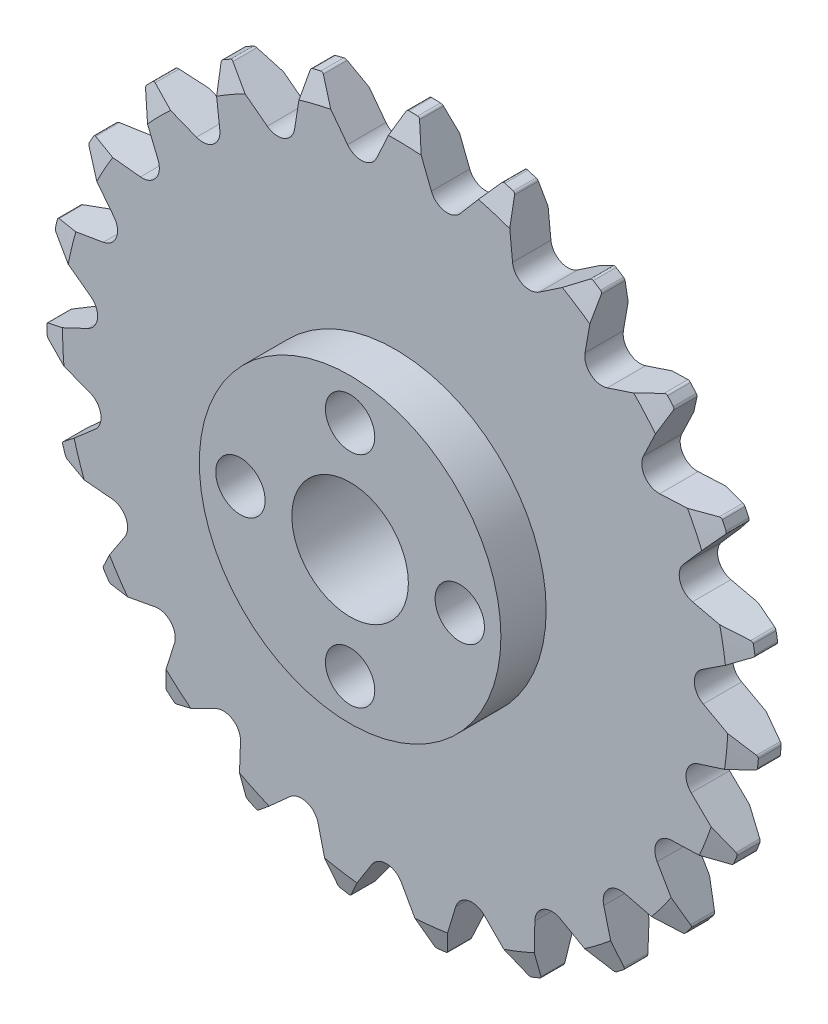
from build123d import *

# Parameters (mm, degrees)
SKETCH1_W                  = 26
SKETCH1_H                  = 2.7999944
CUT_EXTRUDE1_DEPTH         = 37.876008036
CUT_EXTRUDE2_DEPTH         = 37.876008036
CUT_EXTRUDE3_DEPTH         = 37.876008036
CUT_EXTRUDE4_DEPTH         = 37.876008036
CUT_EXTRUDE5_DEPTH         = 37.876008036
CUT_EXTRUDE6_DEPTH         = 37.876008036
CUT_EXTRUDE7_DEPTH         = 37.876008036
CUT_EXTRUDE8_DEPTH         = 37.876008036
CUT_EXTRUDE9_DEPTH         = 37.876008036
CUT_EXTRUDE10_DEPTH        = 37.876008036
CUT_EXTRUDE11_DEPTH        = 37.876008036
CUT_EXTRUDE12_DEPTH        = 37.876008036
CUT_EXTRUDE13_DEPTH        = 37.876008036
CUT_EXTRUDE14_DEPTH        = 37.876008036
CUT_EXTRUDE15_DEPTH        = 37.876008036
CUT_EXTRUDE16_DEPTH        = 37.871323245
CUT_EXTRUDE17_DEPTH        = 37.871323245
CUT_EXTRUDE18_DEPTH        = 37.871323245
CUT_EXTRUDE19_DEPTH        = 37.871323245
CUT_EXTRUDE20_DEPTH        = 37.871323245
CUT_EXTRUDE21_DEPTH        = 37.871323245
CUT_EXTRUDE22_DEPTH        = 37.870167928
CUT_EXTRUDE23_DEPTH        = 37.870167928
SKETCH25_W                 = 11
SKETCH25_H                 = 3.302
F_8_0_8_DIAMETER_HOLE1_D   = 8.5
F_3_6_3_6_DIAMETER_HOLE1_D = 3.6
F_3_6_3_6_DIAMETER_HOLE2_D = 3.6
FILLET1_R                  = 0.2


with BuildPart() as part:
    # Sketch1 → Revolve1 (revolve)
    with BuildSketch(Plane(origin=(0, 0, 0), x_dir=(1, 0, 0), z_dir=(0, 1, 0))):
        with Locations((13, 1.3999972)):
            Rectangle(SKETCH1_W, SKETCH1_H)
    revolve(axis=Axis((0, 0, -2.7999944), (0, 0, 1)))

    # Sketch2 → Cut-Extrude1 (cut, through all)
    with BuildSketch(Plane(origin=(0, 0, -2.7999944), x_dir=(-1, 0, 0), z_dir=(0, 0, -1))):
        with BuildLine():
            Line((18.801313039, 17.958580902), (17.308486788, 14.31139503))
            ThreePointArc((17.308486788, 14.31139503), (17.465043178, 13.088273063), (18.595024492, 12.594634046))
            Line((18.595024492, 12.594634046), (22.514630462, 13.003515492))
            ThreePointArc((22.514630462, 13.003515492), (20.80600791, 15.591986238), (18.801313039, 17.958580902))
        make_face()
    extrude(amount=-CUT_EXTRUDE1_DEPTH, mode=Mode.SUBTRACT)

    # Sketch3 → Cut-Extrude2 (cut, through all)
    with BuildSketch(Plane(origin=(0, 0, -2.7999944), x_dir=(-1, 0, 0), z_dir=(0, 0, -1))):
        with BuildLine():
            Line((22.949276492, 12.220094456), (20.527809316, 9.110915831))
            ThreePointArc((20.527809316, 9.110915831), (20.348565813, 7.890912137), (21.303462141, 7.110713283))
            Line((21.303462141, 7.110713283), (25.188033384, 6.446935261))
            ThreePointArc((25.188033384, 6.446935261), (24.24113224, 9.400399338), (22.949276492, 12.220094456))
        make_face()
    extrude(amount=-CUT_EXTRUDE2_DEPTH, mode=Mode.SUBTRACT)

    # Sketch4 → Cut-Extrude3 (cut, through all)
    with BuildSketch(Plane(origin=(0, 0, -2.7999944), x_dir=(-1, 0, 0), z_dir=(0, 0, -1))):
        with BuildLine():
            Line((25.395197093, 5.575299507), (22.224678136, 3.234721685))
            ThreePointArc((22.224678136, 3.234721685), (21.72292841, 2.108318355), (22.431919461, 1.099423446))
            Line((22.431919461, 1.099423446), (25.993355097, -0.587784666))
            ThreePointArc((25.993355097, -0.587784666), (25.878402688, 2.511627823), (25.395197093, 5.575299507))
        make_face()
    extrude(amount=-CUT_EXTRUDE3_DEPTH, mode=Mode.SUBTRACT)

    # Sketch5 → Cut-Extrude4 (cut, through all)
    with BuildSketch(Plane(origin=(0, 0, -2.7999944), x_dir=(-1, 0, 0), z_dir=(0, 0, -1))):
        with BuildLine():
            Line((25.957672102, -1.482989902), (22.273244249, -2.881376971))
            ThreePointArc((22.273244249, -2.881376971), (21.486200783, -3.830639754), (21.896703933, -4.993405599))
            Line((21.896703933, -4.993405599), (24.870868574, -7.578911293))
            ThreePointArc((24.870868574, -7.578911293), (25.596390394, -4.563419638), (25.957672102, -1.482989902))
        make_face()
    extrude(amount=-CUT_EXTRUDE4_DEPTH, mode=Mode.SUBTRACT)

    # Sketch6 → Cut-Extrude5 (cut, through all)
    with BuildSketch(Plane(origin=(0, 0, -2.7999944), x_dir=(-1, 0, 0), z_dir=(0, 0, -1))):
        with BuildLine():
            Line((24.594985319, -8.431292733), (20.669905729, -8.783777078))
            ThreePointArc((20.669905729, -8.783777078), (19.655939936, -9.485496836), (19.737510045, -10.715896595))
            Line((19.737510045, -10.715896595), (21.903823506, -14.00794474))
            ThreePointArc((21.903823506, -14.00794474), (23.416010921, -11.30001914), (24.594985319, -8.431292733))
        make_face()
    extrude(amount=-CUT_EXTRUDE5_DEPTH, mode=Mode.SUBTRACT)

    # Sketch7 → Cut-Extrude6 (cut, through all)
    with BuildSketch(Plane(origin=(0, 0, -2.7999944), x_dir=(-1, 0, 0), z_dir=(0, 0, -1))):
        with BuildLine():
            Line((21.40820099, -14.754285153), (17.53357486, -14.034724622))
            ThreePointArc((17.53357486, -14.034724622), (16.367887944, -14.436858011), (16.11447533, -15.643638561))
            Line((16.11447533, -15.643638561), (17.312272051, -19.398073008))
            ThreePointArc((17.312272051, -19.398073008), (19.498973038, -17.198547917), (21.40820099, -14.754285153))
        make_face()
    extrude(amount=-CUT_EXTRUDE6_DEPTH, mode=Mode.SUBTRACT)

    # Sketch8 → Cut-Extrude7 (cut, through all)
    with BuildSketch(Plane(origin=(0, 0, -2.7999944), x_dir=(-1, 0, 0), z_dir=(0, 0, -1))):
        with BuildLine():
            Line((16.633668329, -19.98301974), (13.096858955, -18.244780846))
            ThreePointArc((13.096858955, -18.244780846), (11.865904582, -18.317503472), (11.296303699, -19.411163421))
            Line((11.296303699, -19.411163421), (11.436748577, -23.349534942))
            ThreePointArc((11.436748577, -23.349534942), (14.135785527, -21.821539073), (16.633668329, -19.98301974))
        make_face()
    extrude(amount=-CUT_EXTRUDE7_DEPTH, mode=Mode.SUBTRACT)

    # Sketch9 → Cut-Extrude8 (cut, through all)
    with BuildSketch(Plane(origin=(0, 0, -2.7999944), x_dir=(-1, 0, 0), z_dir=(0, 0, -1))):
        with BuildLine():
            Line((10.625492582, -23.729705169), (7.688808935, -21.101705139))
            ThreePointArc((7.688808935, -21.101705139), (6.48388136, -20.839623497), (5.6403369, -21.739051089))
            Line((5.6403369, -21.739051089), (4.713013781, -25.569268685))
            ThreePointArc((4.713013781, -25.569268685), (7.724211471, -24.826126503), (10.625492582, -23.729705169))
        make_face()
    extrude(amount=-CUT_EXTRUDE8_DEPTH, mode=Mode.SUBTRACT)

    # Sketch10 → Cut-Extrude9 (cut, through all)
    with BuildSketch(Plane(origin=(0, 0, -2.7999944), x_dir=(-1, 0, 0), z_dir=(0, 0, -1))):
        with BuildLine():
            Line((3.829272659, -25.716466921), (1.71051513, -22.393612495))
            ThreePointArc((1.71051513, -22.393612495), (0.620978318, -21.816163983), (-0.433947885, -22.454652788))
            Line((-0.433947885, -22.454652788), (-2.360263687, -25.892646742))
            ThreePointArc((-2.360263687, -25.892646742), (0.739767985, -25.989473702), (3.829272659, -25.716466921))
        make_face()
    extrude(amount=-CUT_EXTRUDE9_DEPTH, mode=Mode.SUBTRACT)

    # Sketch11 → Cut-Extrude10 (cut, through all)
    with BuildSketch(Plane(origin=(0, 0, -2.7999944), x_dir=(-1, 0, 0), z_dir=(0, 0, -1))):
        with BuildLine():
            Line((-3.250946899, -25.795955967), (-4.394639757, -22.024688057))
            ThreePointArc((-4.394639757, -22.024688057), (-5.287979844, -21.174699388), (-6.47604874, -21.504895613))
            Line((-6.47604874, -21.504895613), (-9.258491195, -24.295685642))
            ThreePointArc((-9.258491195, -24.295685642), (-6.299540707, -25.225300531), (-3.250946899, -25.795955967))
        make_face()
    extrude(amount=-CUT_EXTRUDE10_DEPTH, mode=Mode.SUBTRACT)

    # Sketch12 → Cut-Extrude11 (cut, through all)
    with BuildSketch(Plane(origin=(0, 0, -2.7999944), x_dir=(-1, 0, 0), z_dir=(0, 0, -1))):
        with BuildLine():
            Line((-10.090058599, -23.962276968), (-10.173864317, -20.022293262))
            ThreePointArc((-10.173864317, -20.022293262), (-10.804752732, -18.962804207), (-12.037850686, -18.960218709))
            Line((-12.037850686, -18.960218709), (-15.470058766, -20.896824682))
            ThreePointArc((-15.470058766, -20.896824682), (-12.871641284, -22.590282217), (-10.090058599, -23.962276968))
        make_face()
    extrude(amount=-CUT_EXTRUDE11_DEPTH, mode=Mode.SUBTRACT)

    # Sketch13 → Cut-Extrude12 (cut, through all)
    with BuildSketch(Plane(origin=(0, 0, -2.7999944), x_dir=(-1, 0, 0), z_dir=(0, 0, -1))):
        with BuildLine():
            Line((-16.18083681, -20.351425506), (-15.198539903, -16.534936571))
            ThreePointArc((-15.198539903, -16.534936571), (-15.520186538, -15.344524588), (-16.706860316, -15.00934912))
            Line((-16.706860316, -15.00934912), (-20.534282848, -15.948141832))
            ThreePointArc((-20.534282848, -15.948141832), (-18.489111111, -18.279846015), (-16.18083681, -20.351425506))
        make_face()
    extrude(amount=-CUT_EXTRUDE12_DEPTH, mode=Mode.SUBTRACT)

    # Sketch14 → Cut-Extrude13 (cut, through all)
    with BuildSketch(Plane(origin=(0, 0, -2.7999944), x_dir=(-1, 0, 0), z_dir=(0, 0, -1))):
        with BuildLine():
            Line((-21.071556378, -15.231201916), (-19.096009313, -11.821259277))
            ThreePointArc((-19.096009313, -11.821259277), (-19.084559109, -10.588211776), (-20.136798545, -9.94530477))
            Line((-20.136798545, -9.94530477), (-24.07557311, -9.816658261))
            ThreePointArc((-24.07557311, -9.816658261), (-22.735328148, -12.613677259), (-21.071556378, -15.231201916))
        make_face()
    extrude(amount=-CUT_EXTRUDE13_DEPTH, mode=Mode.SUBTRACT)

    # Sketch15 → Cut-Extrude14 (cut, through all)
    with BuildSketch(Plane(origin=(0, 0, -2.7999944), x_dir=(-1, 0, 0), z_dir=(0, 0, -1))):
        with BuildLine():
            Line((-24.399495006, -8.981349757), (-21.577215071, -6.230853262))
            ThreePointArc((-21.577215071, -6.230853262), (-21.233517237, -5.046619734), (-22.073282546, -4.143662662))
            Line((-22.073282546, -4.143662662), (-25.831288253, -2.957118055))
            ThreePointArc((-25.831288253, -2.957118055), (-25.295369904, -6.012009764), (-24.399495006, -8.981349757))
        make_face()
    extrude(amount=-CUT_EXTRUDE14_DEPTH, mode=Mode.SUBTRACT)

    # Sketch16 → Cut-Extrude15 (cut, through all)
    with BuildSketch(Plane(origin=(0, 0, -2.7999944), x_dir=(-1, 0, 0), z_dir=(0, 0, -1))):
        with BuildLine():
            Line((-25.917834709, -2.065391975), (-22.458137497, -0.178333364))
            ThreePointArc((-22.458137497, -0.178333364), (-21.807682528, 0.869257006), (-22.372692159, 1.965295949))
            Line((-22.372692159, 1.965295949), (-25.671214916, 4.12173807))
            ThreePointArc((-25.671214916, 4.12173807), (-25.979369793, 1.035540992), (-25.917834709, -2.065391975))
        make_face()
    extrude(amount=-CUT_EXTRUDE15_DEPTH, mode=Mode.SUBTRACT)

    # Sketch17 → Cut-Extrude16 (cut, through all)
    with BuildSketch(Plane(origin=(0, 0, -2.7999944), x_dir=(-1, 0, 0), z_dir=(0, 0, -1))):
        with BuildLine():
            Line((-25.513967178, 5.003746482), (-21.673442603, 5.887412704))
            ThreePointArc((-21.673442603, 5.887412704), (-20.76447177, 6.720664931), (-21.012821543, 7.928497551))
            Line((-21.012821543, 7.928497551), (-23.607225007, 10.894903738))
            ThreePointArc((-23.607225007, 10.894903738), (-24.736598672, 8.00629041), (-25.513967178, 5.003746482))
        make_face()
    extrude(amount=-CUT_EXTRUDE16_DEPTH, mode=Mode.SUBTRACT)

    # Sketch18 → Cut-Extrude17 (cut, through all)
    with BuildSketch(Plane(origin=(0, 0, -2.7999944), x_dir=(-1, 0, 0), z_dir=(0, 0, -1))):
        with BuildLine():
            Line((-23.21784542, 11.701779953), (-19.281327621, 11.516516304))
            ThreePointArc((-19.281327621, 11.516516304), (-18.181255132, 12.073631883), (-18.09452608, 13.30367876))
            Line((-18.09452608, 13.30367876), (-19.792395215, 16.860044236))
            ThreePointArc((-19.792395215, 16.860044236), (-21.65922719, 14.383249894), (-23.21784542, 11.701779953))
        make_face()
    extrude(amount=-CUT_EXTRUDE17_DEPTH, mode=Mode.SUBTRACT)

    # Sketch19 → Cut-Extrude18 (cut, through all)
    with BuildSketch(Plane(origin=(0, 0, -2.7999944), x_dir=(-1, 0, 0), z_dir=(0, 0, -1))):
        with BuildLine():
            Line((-19.199762281, 17.531945937), (-15.459204775, 16.291492575))
            ThreePointArc((-15.459204775, 16.291492575), (-14.249617974, 16.531152791), (-13.834242395, 17.692186975))
            Line((-13.834242395, 17.692186975), (-14.509654015, 21.574752383))
            ThreePointArc((-14.509654015, 21.574752383), (-16.975489912, 19.693469533), (-19.199762281, 17.531945937))
        make_face()
    extrude(amount=-CUT_EXTRUDE18_DEPTH, mode=Mode.SUBTRACT)

    # Sketch20 → Cut-Extrude19 (cut, through all)
    with BuildSketch(Plane(origin=(0, 0, -2.7999944), x_dir=(-1, 0, 0), z_dir=(0, 0, -1))):
        with BuildLine():
            Line((-13.757720608, 22.061847694), (-10.490543432, 19.85820337))
            ThreePointArc((-10.490543432, 19.85820337), (-9.261151839, 19.762633722), (-8.547936239, 20.768546619))
            Line((-8.547936239, 20.768546619), (-8.150798153, 24.689359843))
            ThreePointArc((-8.150798153, 24.689359843), (-11.032758204, 23.543114628), (-13.757720608, 22.061847694))
        make_face()
    extrude(amount=-CUT_EXTRUDE19_DEPTH, mode=Mode.SUBTRACT)

    # Sketch21 → Cut-Extrude20 (cut, through all)
    with BuildSketch(Plane(origin=(0, 0, -2.7999944), x_dir=(-1, 0, 0), z_dir=(0, 0, -1))):
        with BuildLine():
            Line((-7.295331734, 24.955523134), (-4.743846474, 21.952122067))
            ThreePointArc((-4.743846474, 21.952122067), (-3.585828439, 21.528410517), (-2.627668756, 22.30459817))
            Line((-2.627668756, 22.30459817), (-1.187434879, 25.972870431))
            ThreePointArc((-1.187434879, 25.972870431), (-4.271777292, 25.646674614), (-7.295331734, 24.955523134))
        make_face()
    extrude(amount=-CUT_EXTRUDE20_DEPTH, mode=Mode.SUBTRACT)

    # Sketch22 → Cut-Extrude21 (cut, through all)
    with BuildSketch(Plane(origin=(0, 0, -2.7999944), x_dir=(-1, 0, 0), z_dir=(0, 0, -1))):
        with BuildLine():
            Line((-0.29188148, 25.998361587), (1.354679875, 22.417952294))
            ThreePointArc((1.354679875, 22.417952294), (2.355439453, 21.697523591), (3.487480897, 22.186419711))
            Line((3.487480897, 22.186419711), (5.863995007, 25.330092036))
            ThreePointArc((5.863995007, 25.330092036), (2.806021799, 25.84813807), (-0.29188148, 25.998361587))
        make_face()
    extrude(amount=-CUT_EXTRUDE21_DEPTH, mode=Mode.SUBTRACT)

    # Sketch23 → Cut-Extrude22 (cut, through all)
    with BuildSketch(Plane(origin=(0, 0, -2.7999944), x_dir=(-1, 0, 0), z_dir=(0, 0, -1))):
        with BuildLine():
            Line((6.733216289, 25.113020495), (7.352735815, 21.221145554))
            ThreePointArc((7.352735815, 21.221145554), (8.122015175, 20.257430599), (9.343980047, 20.422775999))
            Line((9.343980047, 20.422775999), (12.48051921, 22.808696593))
            ThreePointArc((12.48051921, 22.808696593), (9.675711091, 24.132563372), (6.733216289, 25.113020495))
        make_face()
    extrude(amount=-CUT_EXTRUDE22_DEPTH, mode=Mode.SUBTRACT)

    # Sketch24 → Cut-Extrude23 (cut, through all)
    with BuildSketch(Plane(origin=(0, 0, -2.7999944), x_dir=(-1, 0, 0), z_dir=(0, 0, -1))):
        with BuildLine():
            Line((13.258942208, 22.365161558), (12.805472976, 18.45046353))
            ThreePointArc((12.805472976, 18.45046353), (13.286218188, 17.314936652), (14.507478942, 17.144468418))
            Line((14.507478942, 17.144468418), (18.171420397, 18.595684466))
            ThreePointArc((18.171420397, 18.595684466), (15.827797154, 20.627186848), (13.258942208, 22.365161558))
        make_face()
    extrude(amount=-CUT_EXTRUDE23_DEPTH, mode=Mode.SUBTRACT)

    # Sketch25 → Revolve2 (revolve)
    with BuildSketch(Plane(origin=(0, 0, 0), x_dir=(1, 0, 0), z_dir=(0, 1, 0))):
        with Locations((5.5, -1.651)):
            Rectangle(SKETCH25_W, SKETCH25_H)
    revolve(axis=Axis((0, 0, 0), (0, 0, 1)))

    # Ø8.0 (8) Diameter Hole1 (through all)
    with Locations(Plane.XY.offset(3.302)):
        with Locations((0, 0)):
            Hole(F_8_0_8_DIAMETER_HOLE1_D / 2)

    # Ø3.6 (3.6) Diameter Hole1 (through all)
    with Locations(Plane.XY.offset(3.302)):
        with Locations((0, 8), (-8, 0), (0, -8)):
            Hole(F_3_6_3_6_DIAMETER_HOLE1_D / 2)

    # Ø3.6 (3.6) Diameter Hole2 (through all)
    with Locations(Plane(origin=(0, 0, -2.7999944), x_dir=(-1, 0, 0), z_dir=(0, 0, -1))):
        with Locations((-8, 0)):
            Hole(F_3_6_3_6_DIAMETER_HOLE2_D / 2)

    # Fillet1
    fillet1_edges = [part.edges().sort_by_distance(p)[0] for p in [
        (-16.633668329, -19.98301974, -1.3999972),
        (-11.436748577, -23.349534942, -1.3999972),
        (-10.625492582, -23.729705169, -1.3999972),
        (-4.713013781, -25.569268685, -1.3999972),
        (-18.801313039, 17.958580902, -1.3999972),
        (-22.514630462, 13.003515492, -1.3999972),
        (-3.829272659, -25.716466921, -1.3999972),
        (2.360263687, -25.892646742, -1.3999972),
        (3.250946899, -25.795955967, -1.3999972),
        (9.258491195, -24.295685642, -1.3999972),
        (10.090058599, -23.962276968, -1.3999972),
        (15.470058766, -20.896824682, -1.3999972),
        (16.18083681, -20.351425506, -1.3999972),
        (20.534282848, -15.948141832, -1.3999972),
        (21.071556378, -15.231201916, -1.3999972),
        (24.07557311, -9.816658261, -1.3999972),
        (24.399495006, -8.981349757, -1.3999972),
        (25.831288253, -2.957118055, -1.3999972),
        (25.917834709, -2.065391975, -1.3999972),
        (25.671214916, 4.12173807, -1.3999972),
        (25.513967178, 5.003746482, -1.3999972),
        (23.607225007, 10.894903738, -1.3999972),
        (23.21784542, 11.701779953, -1.3999972),
        (19.792395215, 16.860044236, -1.3999972),
        (-22.949276492, 12.220094456, -1.3999972),
        (-25.188033384, 6.446935261, -1.3999972),
        (19.199762281, 17.531945937, -1.3999972),
        (14.509654015, 21.574752383, -1.3999972),
        (13.757720608, 22.061847694, -1.3999972),
        (8.150798153, 24.689359843, -1.3999972),
        (7.295331734, 24.955523134, -1.3999972),
        (1.187434879, 25.972870431, -1.3999972),
        (0.29188148, 25.998361587, -1.3999972),
        (-5.863995007, 25.330092036, -1.3999972),
        (-6.733216289, 25.113020495, -1.3999972),
        (-12.48051921, 22.808696593, -1.3999972),
        (-13.258942208, 22.365161558, -1.3999972),
        (-18.171420397, 18.595684466, -1.3999972),
        (-25.395197093, 5.575299507, -1.3999972),
        (-25.993355097, -0.587784666, -1.3999972),
        (-25.957672102, -1.482989902, -1.3999972),
        (-24.870868574, -7.578911293, -1.3999972),
        (-24.594985319, -8.431292733, -1.3999972),
        (-21.903823506, -14.00794474, -1.3999972),
        (-21.40820099, -14.754285153, -1.3999972),
        (-17.312272051, -19.398073008, -1.3999972),
    ]]
    fillet(fillet1_edges, radius=FILLET1_R)

    # Sketch32 → Cut-Revolve1 (revolve, cut)
    with BuildSketch(Plane(origin=(0, 0, 0), x_dir=(0, 0, -1), z_dir=(1, 0, 0)), mode=Mode.PRIVATE) as cut_revolve1_sk:
        Polygon((0, 24.2697), (0, 26.0477), (0.5842, 26.0477), align=None)
        Polygon((2.2157944, 26.0477), (2.7999944, 24.2697), (2.7999944, 26.0477), align=None)
    revolve(cut_revolve1_sk.sketch.rotate(Axis((0, 0, 0), (0, 0, -1)), 90), axis=Axis((0, 0, 0), (0, 0, -1)), mode=Mode.SUBTRACT)


solid = part.part
